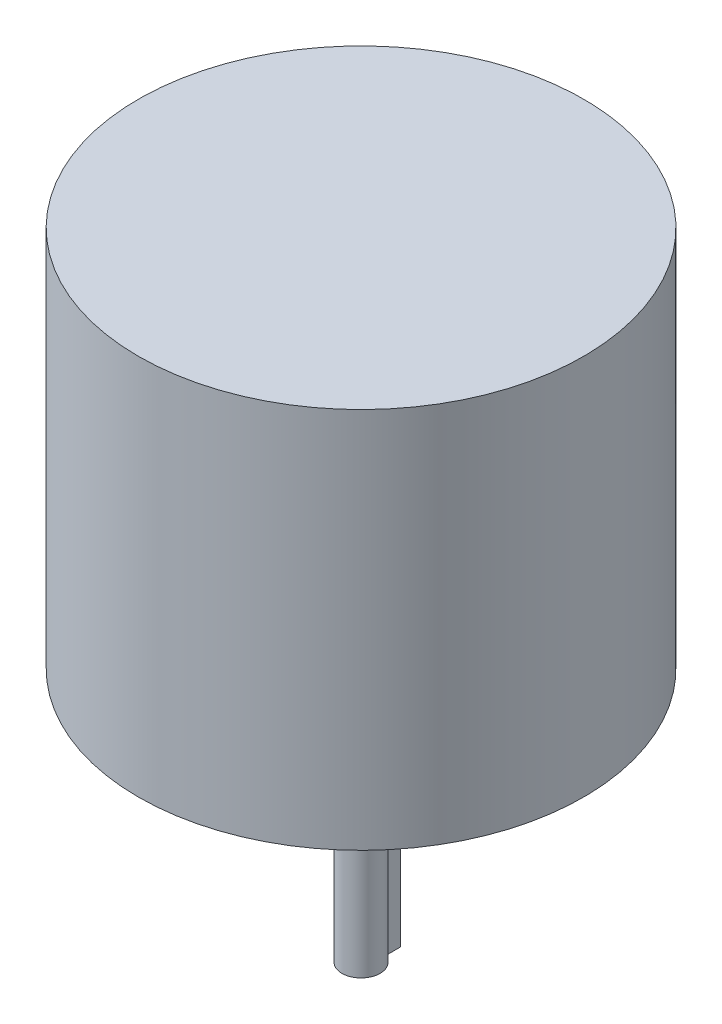
from build123d import *

# Parameters (mm, degrees)
SKETCH1_R           = 17.5
BOSS_EXTRUDE1_DEPTH = 30
SKETCH2_W           = 22.36
SKETCH2_H           = 22
CUT_EXTRUDE1_DEPTH  = 30
BOSS_EXTRUDE2_DEPTH = 20


with BuildPart() as part:
    # Sketch1 → Boss-Extrude1 (new body)
    with BuildSketch(Plane(origin=(0, 0, 0), x_dir=(1, 0, 0), z_dir=(0, 1, 0))):
        Circle(SKETCH1_R)
    extrude(amount=BOSS_EXTRUDE1_DEPTH)

    # Sketch2 → Cut-Extrude1 (cut)
    with BuildSketch(Plane(origin=(0, 0, 0), x_dir=(0, 0, -1), z_dir=(1, 0, 0))):
        with Locations((0, 15)):
            Rectangle(SKETCH2_W, SKETCH2_H)
    extrude(amount=-CUT_EXTRUDE1_DEPTH, mode=Mode.SUBTRACT)

    # Sketch3 → Boss-Extrude2 (add)
    with BuildSketch(Plane.XZ):
        with BuildLine():
            Line((-0.5, -1.414213562), (-0.5, -2.6))
            Line((-0.5, -2.6), (0.5, -2.6))
            Line((0.5, -2.6), (0.5, -1.414213562))
            ThreePointArc((0.5, -1.414213562), (0, 1.5), (-0.5, -1.414213562))
        make_face()
    extrude(amount=BOSS_EXTRUDE2_DEPTH)


solid = part.part
